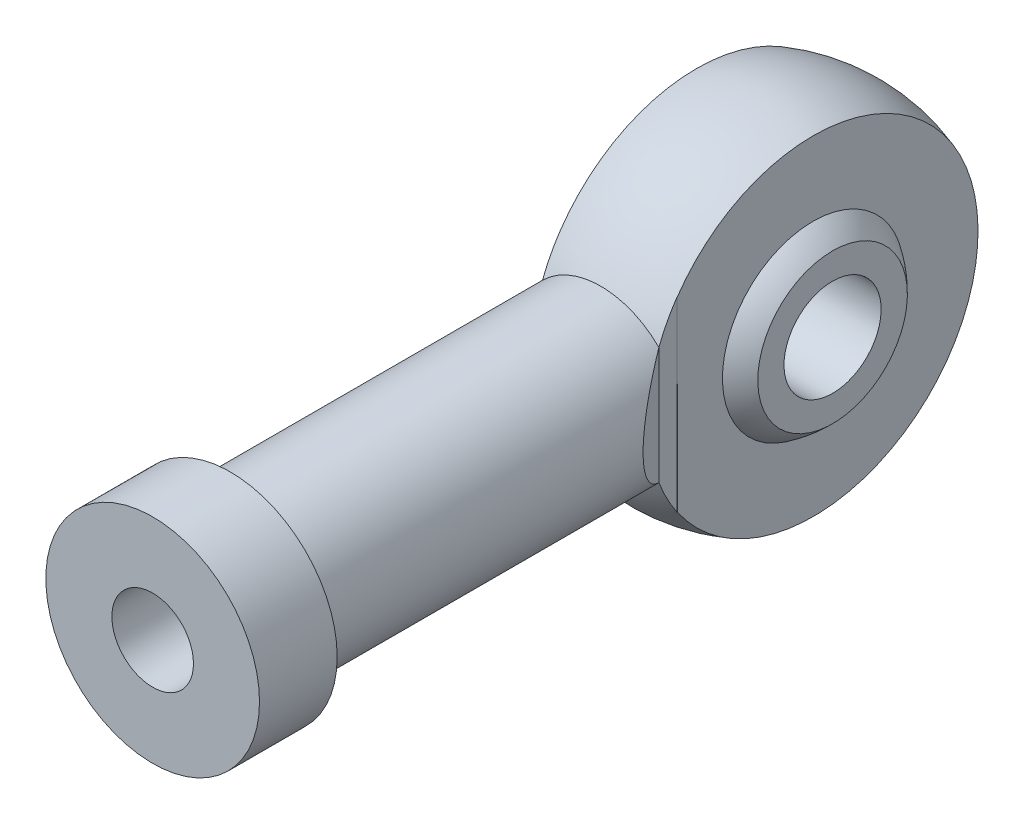
from build123d import *

# Parameters (mm, degrees)
SKETCH_3_R             = 5.5
EXTRUDE_2_DEPTH        = 4
SKETCH_4_R             = 4.25
EXTRUDE_3_DEPTH        = 20
CUT_EXTRUDE_1_DEPTH    = 10
HOLE_WIZARD_M5_1_D     = 4.2
HOLE_WIZARD_M5_1_DEPTH = 12.4
HOLE_WIZARD_M5_1_TIP   = 1.2618073


with BuildPart() as part:
    # 草图1 → 旋转1 (revolve)
    with BuildSketch(Plane.XY):
        with BuildLine():
            Line((-4, 3.854610875), (-4, 2.495599217))
            Line((-4, 2.495599217), (4, 2.504403811))
            Line((4, 2.504403811), (4, 3.854610875))
            ThreePointArc((4, 3.854610875), (3.523970046, 4.294142536), (3, 4.675256677))
            Line((3, 4.675256677), (3, 8.485281374))
            ThreePointArc((3, 8.485281374), (0, 9), (-3, 8.485281374))
            Line((-3, 8.485281374), (-3, 4.675256677))
            ThreePointArc((-3, 4.675256677), (-3.523970046, 4.294142536), (-4, 3.854610875))
        make_face()
    revolve(axis=Axis((3.999995155, 0.004402291, 0), (-0.9999993943687722, -0.0011005735273187716, 0)))



with BuildPart() as body_2:
    # 草图3 → 凸台-拉伸2 (new body)
    with BuildSketch(Plane.XY.offset(27)):
        Circle(SKETCH_3_R)
    extrude(amount=EXTRUDE_2_DEPTH)


with BuildPart() as part_1:
    add(part.part)

    add(body_2.part)  # 凸台-拉伸3 merges body 2
    # 草图4 → 凸台-拉伸3 (add)
    with BuildSketch(Plane(origin=(0, 0, 27), x_dir=(-1, 0, 0), z_dir=(0, 0, -1))):
        with Locations(Location((0, 0, 0), (0, 0, 180))):
            Circle(SKETCH_4_R)
    extrude(amount=EXTRUDE_3_DEPTH)

    # 草图5 → 切除-拉伸1 (cut, symmetric)
    with BuildSketch(Plane(origin=(0, 0, 0), x_dir=(1, 0, 0), z_dir=(0, 1, 0))):
        Polygon((-2.994932477, -7), (-2.994932477, -7.933315826), (-4.25, -10), (-4.25, -7), align=None)
        Polygon((4.25, -7), (2.994932477, -7), (2.994932477, -7.933315826), (4.25, -10), align=None)
    extrude(amount=CUT_EXTRUDE_1_DEPTH, both=True, mode=Mode.SUBTRACT)

    # M5 螺纹孔1
    with Locations(Plane.XY.offset(31)):
        with Locations((0, 0)):
            Hole(HOLE_WIZARD_M5_1_D / 2, depth=HOLE_WIZARD_M5_1_DEPTH)
            with Locations((0, 0, -(HOLE_WIZARD_M5_1_DEPTH + HOLE_WIZARD_M5_1_TIP / 2))):  # 118° drill point
                Cone(0, HOLE_WIZARD_M5_1_D / 2, HOLE_WIZARD_M5_1_TIP, mode=Mode.SUBTRACT)


solid = part_1.part
